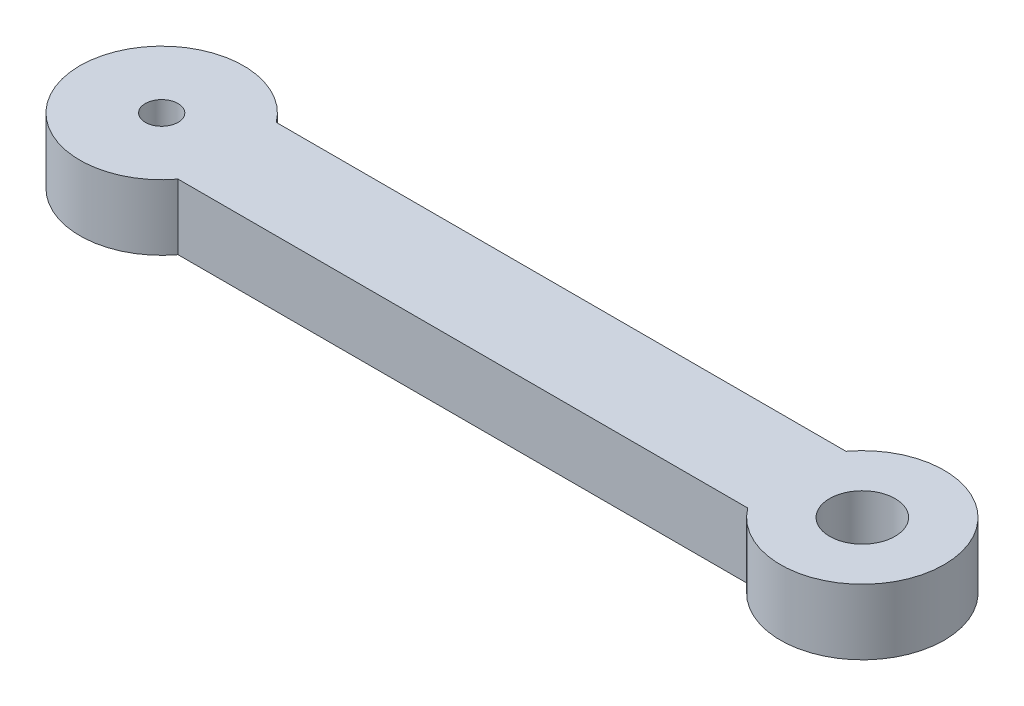
from build123d import *

# Parameters (mm, degrees)
SKETCH1_R           = 1
SKETCH1_R_2         = 0.5
BOSS_EXTRUDE1_DEPTH = 2


with BuildPart() as part:
    # Sketch1 → Boss-Extrude1 (new body)
    with BuildSketch(Plane(origin=(0, 0, 0), x_dir=(1, 0, 0), z_dir=(0, 1, 0))):
        with BuildLine():
            Line((-8.7, 1.5), (8.7, 1.5))
            ThreePointArc((8.7, 1.5), (13.2, 0), (8.7, -1.5))
            Line((8.7, -1.5), (-8.7, -1.5))
            ThreePointArc((-8.7, -1.5), (-13.2, 0), (-8.7, 1.5))
        make_face()
        with Locations(Location((10.7, 0, 0), (0, 0, 270))):
            Circle(SKETCH1_R, mode=Mode.SUBTRACT)
        with Locations(Location((-10.7, 0, 0), (0, 0, 270))):
            Circle(SKETCH1_R_2, mode=Mode.SUBTRACT)
    extrude(amount=BOSS_EXTRUDE1_DEPTH)


solid = part.part
